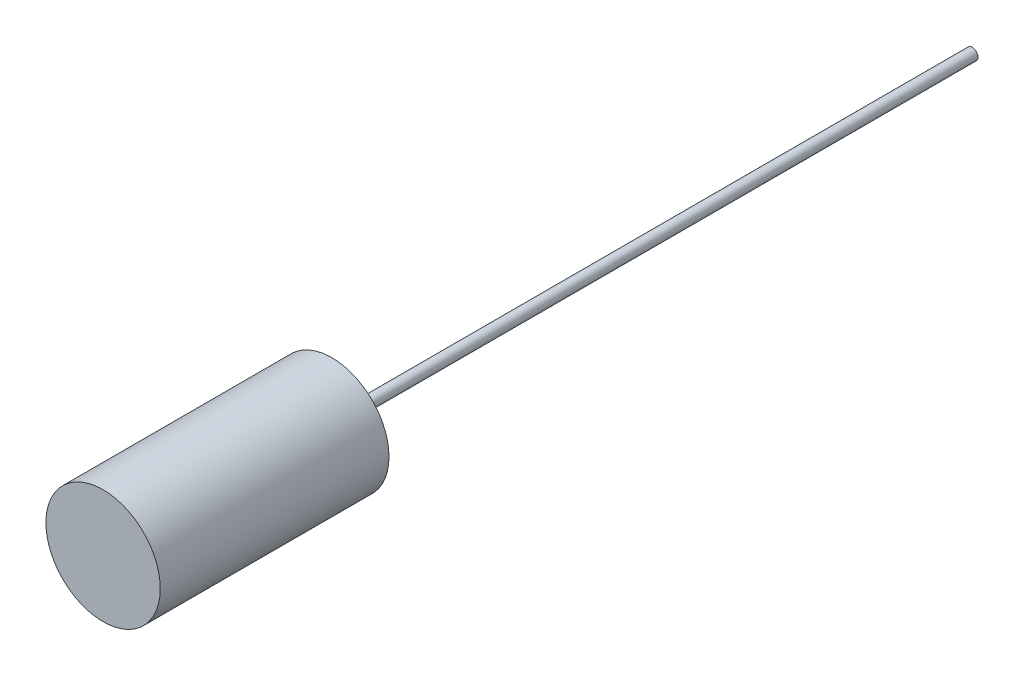
from build123d import *

# Parameters (mm, degrees)
SKETCH_1_R      = 5
EXTRUDE_1_DEPTH = 20
SKETCH_2_R      = 0.5
EXTRUDE_2_DEPTH = 56


with BuildPart() as part:
    # 草图1 → 凸台-拉伸1 (new body)
    with BuildSketch(Plane.XY):
        Circle(SKETCH_1_R)
    extrude(amount=EXTRUDE_1_DEPTH)

    # 草图2 → 凸台-拉伸2 (add)
    with BuildSketch(Plane(origin=(0, 0, 0), x_dir=(-1, 0, 0), z_dir=(0, 0, -1))):
        with Locations(Location((0, 0, 0), (0, 0, 180))):
            Circle(SKETCH_2_R)
    extrude(amount=EXTRUDE_2_DEPTH)


solid = part.part
